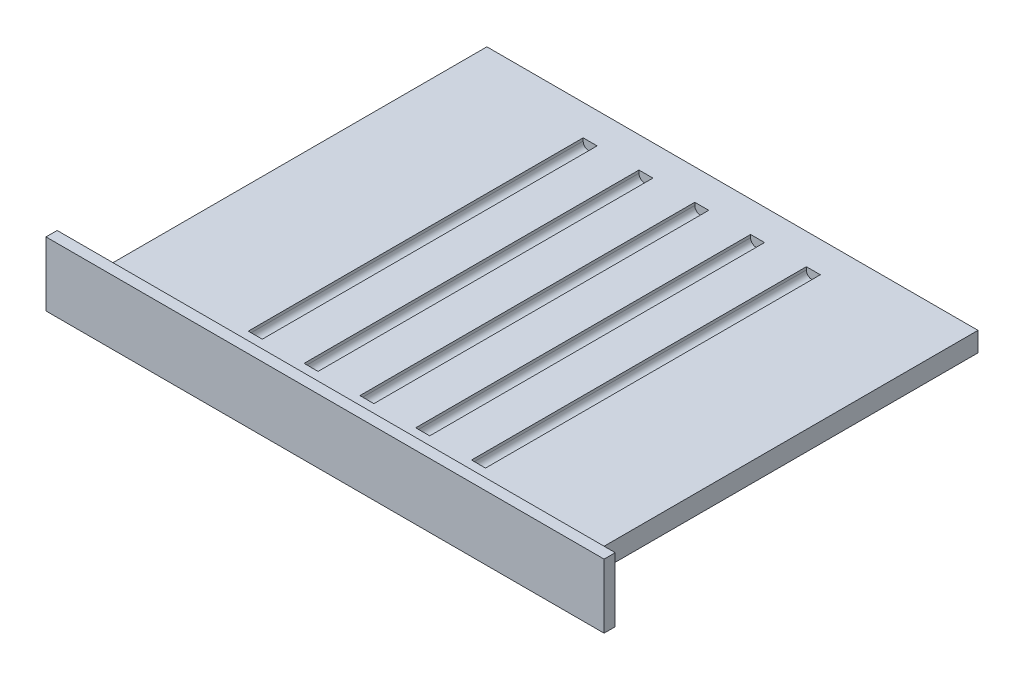
from build123d import *

# Parameters (mm, degrees)
SKETCH1_W           = 176
SKETCH1_H           = 142
BOSS_EXTRUDE1_DEPTH = 7
SKETCH2_W           = 192
SKETCH2_H           = 23
BOSS_EXTRUDE2_DEPTH = 4
SKETCH3_W           = 146
SKETCH3_H           = 112
CUT_EXTRUDE1_DEPTH  = 3
SKETCH4_W           = 5
SKETCH4_H           = 120
CUT_EXTRUDE2_DEPTH  = 3
FILLET1_R           = 2
SKETCH6_W           = 4
SKETCH6_H           = 23
BOSS_EXTRUDE3_DEPTH = 4
SKETCH7_W           = 4
SKETCH7_H           = 23
BOSS_EXTRUDE4_DEPTH = 4
SKETCH5_R           = 3
CUT_EXTRUDE3_DEPTH  = 190.179668735
SKETCH8_R           = 3
BOSS_EXTRUDE5_DEPTH = 2


with BuildPart() as part:
    # Sketch1 → Boss-Extrude1 (new body)
    with BuildSketch(Plane(origin=(0, 0, 0), x_dir=(1, 0, 0), z_dir=(0, 1, 0))):
        with Locations((19.364764745, -37.446274738)):
            Rectangle(SKETCH1_W, SKETCH1_H)
    extrude(amount=BOSS_EXTRUDE1_DEPTH)

    # Sketch2 → Boss-Extrude2 (add)
    with BuildSketch(Plane.XY.offset(108.446274738)):
        with Locations((19.364764745, 3.5)):
            Rectangle(SKETCH2_W, SKETCH2_H)
    extrude(amount=BOSS_EXTRUDE2_DEPTH)

    # Sketch3 → Cut-Extrude1 (cut)
    with BuildSketch(Plane.XZ):
        with Locations((19.364764745, 37.446274738)):
            Rectangle(SKETCH3_W, SKETCH3_H)
    extrude(amount=-CUT_EXTRUDE1_DEPTH, mode=Mode.SUBTRACT)

    # Sketch4 → Cut-Extrude2 (cut)
    with BuildSketch(Plane(origin=(0, 7, 0), x_dir=(1, 0, 0), z_dir=(0, 1, 0))):
        with Locations((19.364764745, -37.446274738)):
            Rectangle(SKETCH4_W, SKETCH4_H)
        with Locations((39.364764745, -37.446274738)):
            Rectangle(SKETCH4_W, SKETCH4_H)
        with Locations((-0.635235255, -37.446274738)):
            Rectangle(SKETCH4_W, SKETCH4_H)
        with Locations((59.364764745, -37.446274738)):
            Rectangle(SKETCH4_W, SKETCH4_H)
        with Locations((-20.635235255, -37.446274738)):
            Rectangle(SKETCH4_W, SKETCH4_H)
    extrude(amount=-CUT_EXTRUDE2_DEPTH, mode=Mode.SUBTRACT)

    # Fillet1
    fillet1_edges = [part.edges().sort_by_distance(p)[0] for p in [
        (41.864764745, 4, 37.446274738),
        (36.864764745, 4, 37.446274738),
        (-3.135235255, 4, 37.446274738),
        (1.864764745, 4, 37.446274738),
        (61.864764745, 4, 37.446274738),
        (56.864764745, 4, 37.446274738),
        (-23.135235255, 4, 37.446274738),
        (-18.135235255, 4, 37.446274738),
        (21.864764745, 4, 37.446274738),
        (16.864764745, 4, 37.446274738),
    ]]
    fillet(fillet1_edges, radius=FILLET1_R)

    # Sketch6 → Boss-Extrude3 (add)
    with BuildSketch(Plane.ZY.offset(76.635235255)):
        with Locations((110.446274738, 3.5)):
            Rectangle(SKETCH6_W, SKETCH6_H)
    extrude(amount=BOSS_EXTRUDE3_DEPTH)

    # Sketch7 → Boss-Extrude4 (add)
    with BuildSketch(Plane(origin=(115.364764745, 0, 0), x_dir=(0, 0, -1), z_dir=(1, 0, 0))):
        with Locations((-110.446274738, 3.5)):
            Rectangle(SKETCH7_W, SKETCH7_H)
    extrude(amount=BOSS_EXTRUDE4_DEPTH)

    # Sketch5 → Cut-Extrude3 (cut, through all)
    with BuildSketch(Plane.XY.offset(112.446274738)):
        with Locations((-75.635235255, 3.5)):
            Circle(SKETCH5_R)
        with Locations((114.364764745, 3.5)):
            Circle(SKETCH5_R)
    extrude(amount=-CUT_EXTRUDE3_DEPTH, mode=Mode.SUBTRACT)

    # Sketch8 → Boss-Extrude5 (add)
    with BuildSketch(Plane.XY.offset(112.446274738)):
        with Locations((-75.635235255, 3.5)):
            Circle(SKETCH8_R)
        with Locations((114.364764745, 3.5)):
            Circle(SKETCH8_R)
    extrude(amount=-BOSS_EXTRUDE5_DEPTH)


solid = part.part
